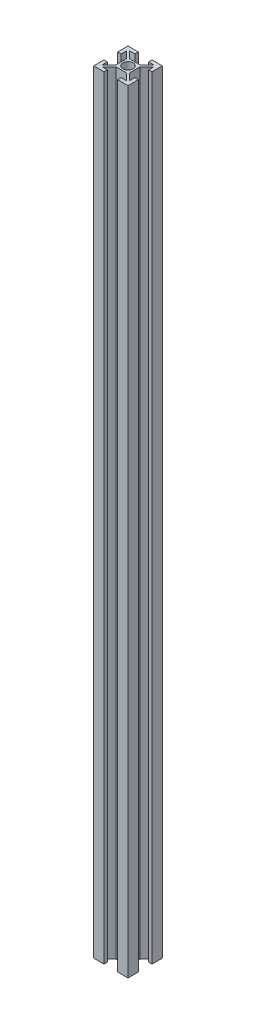
from build123d import *

# Parameters (mm, degrees)
BOSS_EXTRUDE1_START = -12.168666
F_2020_SKETCH_R     = 3
BOSS_EXTRUDE1_DEPTH = 450


with BuildPart() as part:
    # 2020 sketch → Boss-Extrude1 (new body)
    with BuildSketch(Plane(origin=(0, 0, 0), x_dir=(1, 0, 0), z_dir=(0, 1, 0)).offset(BOSS_EXTRUDE1_START)):
        Polygon((-4, 10), (-4, 8), (-7, 8), (-3, 4), (3, 4), (7, 8), (4, 8), (4, 10), (10, 10), (10, 4), (8, 4), (8, 7), (4, 3), (4, -3), (8, -7), (8, -4), (10, -4), (10, -10), (4, -10), (4, -8), (7, -8), (3, -4), (-3, -4), (-7, -8), (-4, -8), (-4, -10), (-10, -10), (-10, -4), (-8, -4), (-8, -7), (-4, -3), (-4, 3), (-8, 7), (-8, 4), (-10, 4), (-10, 10), align=None)
        with Locations(Location((0, 0, 0), (0, 0, 270))):
            Circle(F_2020_SKETCH_R, mode=Mode.SUBTRACT)
    extrude(amount=BOSS_EXTRUDE1_DEPTH)


solid = part.part
